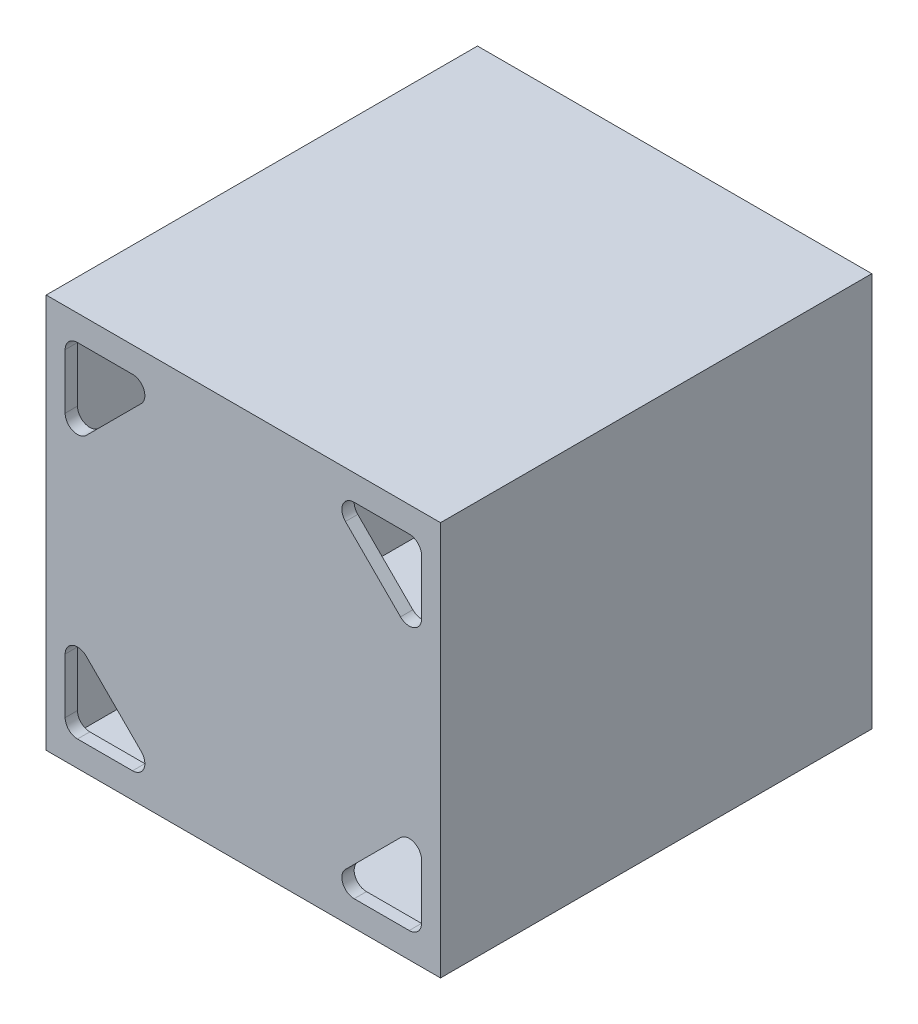
from build123d import *

# Parameters (mm, degrees)
SKETCH1_W           = 81.28
SKETCH1_H           = 81.28
BOSS_EXTRUDE1_DEPTH = 88.9
SHELL1_T            = -2.54
SKETCH4_W           = 78.74
SKETCH4_H           = 78.74
CUT_EXTRUDE2_DEPTH  = 5.08
CUT_EXTRUDE3_DEPTH  = 17.78


with BuildPart() as part:
    # Sketch1 → Boss-Extrude1 (new body)
    with BuildSketch(Plane.XY):
        Rectangle(SKETCH1_W, SKETCH1_H)
    extrude(amount=BOSS_EXTRUDE1_DEPTH)

    # Shell1
    shell1_openings = [part.faces().sort_by_distance(p)[0] for p in [
        (0, 0, 0),
    ]]
    offset(amount=SHELL1_T, openings=shell1_openings, kind=Kind.INTERSECTION)

    # Sketch4 → Cut-Extrude2 (cut)
    with BuildSketch(Plane(origin=(0, 0, 0), x_dir=(-1, 0, 0), z_dir=(0, 0, -1))):
        Rectangle(SKETCH4_W, SKETCH4_H)
    extrude(amount=-CUT_EXTRUDE2_DEPTH, mode=Mode.SUBTRACT)

    # Sketch5 → Cut-Extrude3 (cut)
    with BuildSketch(Plane.XY.offset(88.9)):
        with BuildLine():
            Line((-36.729338969, 32.846931931), (-36.729338969, 21.496884439))
            ThreePointArc((-36.729338969, 21.496884439), (-35.161354887, 19.150230426), (-32.393287744, 19.700833215))
            Line((-32.393287744, 19.700833215), (-21.043240252, 31.050880707))
            ThreePointArc((-21.043240252, 31.050880707), (-20.492637463, 33.81894785), (-22.839291476, 35.386931931))
            Line((-22.839291476, 35.386931931), (-34.189338969, 35.386931931))
            ThreePointArc((-34.189338969, 35.386931931), (-35.985390193, 34.642983156), (-36.729338969, 32.846931931))
        make_face()
        with BuildLine():
            Line((32.393287744, 19.700833215), (21.043240252, 31.050880707))
            ThreePointArc((21.043240252, 31.050880707), (20.492637463, 33.81894785), (22.839291476, 35.386931931))
            Line((22.839291476, 35.386931931), (34.189338969, 35.386931931))
            ThreePointArc((34.189338969, 35.386931931), (35.985390193, 34.642983156), (36.729338969, 32.846931931))
            Line((36.729338969, 32.846931931), (36.729338969, 21.496884439))
            ThreePointArc((36.729338969, 21.496884439), (35.161354887, 19.150230426), (32.393287744, 19.700833215))
        make_face()
        with BuildLine():
            Line((32.393287744, -19.700833215), (21.043240252, -31.050880707))
            ThreePointArc((21.043240252, -31.050880707), (20.492637463, -33.81894785), (22.839291476, -35.386931931))
            Line((22.839291476, -35.386931931), (34.189338969, -35.386931931))
            ThreePointArc((34.189338969, -35.386931931), (35.985390193, -34.642983156), (36.729338969, -32.846931931))
            Line((36.729338969, -32.846931931), (36.729338969, -21.496884439))
            ThreePointArc((36.729338969, -21.496884439), (35.161354887, -19.150230426), (32.393287744, -19.700833215))
        make_face()
        with BuildLine():
            Line((-32.393287744, -19.700833215), (-21.043240252, -31.050880707))
            ThreePointArc((-21.043240252, -31.050880707), (-20.492637463, -33.81894785), (-22.839291476, -35.386931931))
            Line((-22.839291476, -35.386931931), (-34.189338969, -35.386931931))
            ThreePointArc((-34.189338969, -35.386931931), (-35.985390193, -34.642983156), (-36.729338969, -32.846931931))
            Line((-36.729338969, -32.846931931), (-36.729338969, -21.496884439))
            ThreePointArc((-36.729338969, -21.496884439), (-35.161354887, -19.150230426), (-32.393287744, -19.700833215))
        make_face()
    extrude(amount=-CUT_EXTRUDE3_DEPTH, mode=Mode.SUBTRACT)


solid = part.part
